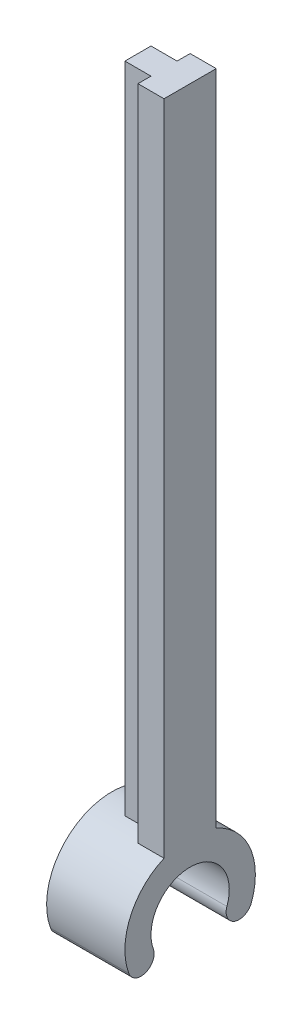
from build123d import *

# Parameters (mm, degrees)
BOSS_EXTRUDE1_DEPTH      = 2
BOSS_EXTRUDE1_DEPTH_BACK = 4
BOSS_EXTRUDE2_DEPTH      = 2
BOSS_EXTRUDE3_DEPTH      = 2


with BuildPart() as part:
    # Sketch1 → Boss-Extrude1 (new, two sides: drawn at the far end of the back side and taken through both)
    with BuildSketch(Plane(origin=(0, 0, 0), x_dir=(0, 0, -1), z_dir=(1, 0, 0)).offset(-BOSS_EXTRUDE1_DEPTH_BACK)):
        with BuildLine():
            Line((-5, 0), (-3, 0))
            ThreePointArc((-3, 0), (0, 3), (3, 0))
            ThreePointArc((3, 0), (2.954423259, -0.520944533), (2.819077862, -1.02606043))
            Line((2.819077862, -1.02606043), (4.698463104, -1.710100717))
            ThreePointArc((4.698463104, -1.710100717), (4.924038765, -0.868240888), (5, 0))
            ThreePointArc((5, 0), (0, 5), (-5, 0))
        make_face()
        with BuildLine():
            Line((4.698463104, -1.710100717), (2.819077862, -1.02606043))
            ThreePointArc((2.819077862, -1.02606043), (3.41675034, -2.307773194), (4.698463104, -1.710100717))
        make_face()
        with BuildLine():
            ThreePointArc((-2.819077862, -1.02606043), (-2.954423259, -0.520944533), (-3, 0))
            Line((-3, 0), (-5, 0))
            ThreePointArc((-5, 0), (-4.924038765, -0.868240888), (-4.698463104, -1.710100717))
            Line((-4.698463104, -1.710100717), (-3.758770483, -1.368080573))
            Line((-3.758770483, -1.368080573), (-2.819077862, -1.02606043))
        make_face()
        with BuildLine():
            ThreePointArc((-4.698463104, -1.710100717), (-3.41675034, -2.307773194), (-2.819077862, -1.02606043))
            Line((-2.819077862, -1.02606043), (-3.758770483, -1.368080573))
            Line((-3.758770483, -1.368080573), (-4.698463104, -1.710100717))
        make_face()
    extrude(amount=BOSS_EXTRUDE1_DEPTH + BOSS_EXTRUDE1_DEPTH_BACK)

    # Sketch2 → Boss-Extrude2 (add)
    with BuildSketch(Plane(origin=(0, 0, 0), x_dir=(0, 0, -1), z_dir=(1, 0, 0))):
        Polygon((-2, 3), (0, 3), (2, 3), (2, 55), (-2, 55), align=None)
    extrude(amount=BOSS_EXTRUDE2_DEPTH)

    # Sketch3 → Boss-Extrude3 (add)
    with BuildSketch(Plane(origin=(0, 0, 0), x_dir=(0, 0, -1), z_dir=(1, 0, 0))):
        Polygon((1, 55), (0, 55), (-1, 55), (-1, 3), (1, 3), align=None)
    extrude(amount=-BOSS_EXTRUDE3_DEPTH)


solid = part.part
